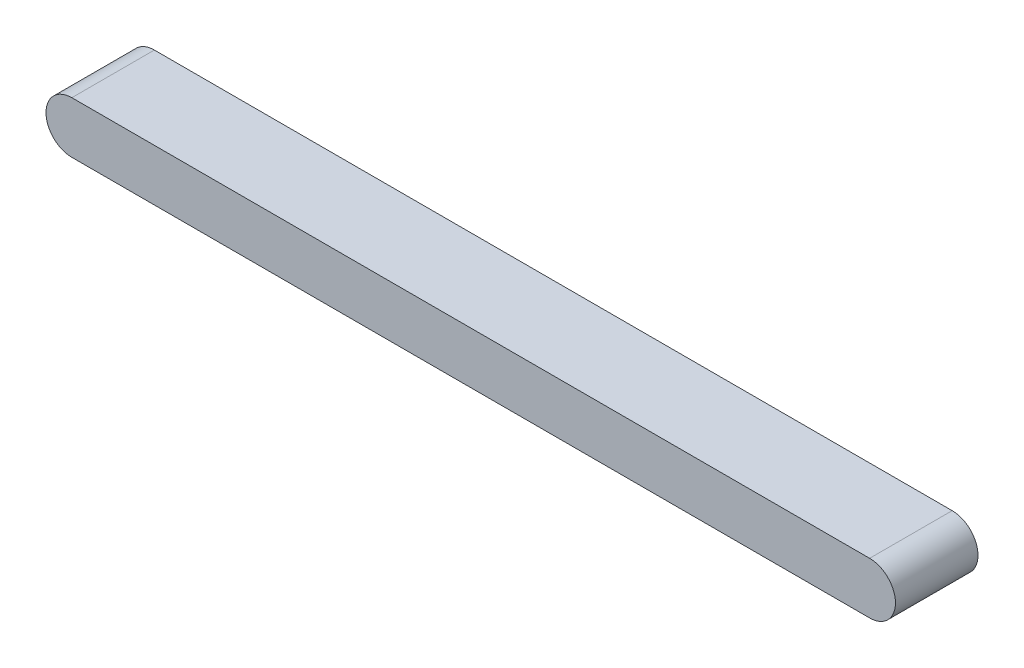
from build123d import *

# Parameters (mm, degrees)
EXTRUDE_1_DEPTH = 7.5


with BuildPart() as part:
    # 草图1 → 凸台-拉伸1 (new, symmetric)
    with BuildSketch(Plane.XY):
        with BuildLine():
            Line((0, 4.695484364), (145, 4.695484364))
            ThreePointArc((145, 4.695484364), (149.695484364, 0), (145, -4.695484364))
            Line((145, -4.695484364), (0, -4.695484364))
            ThreePointArc((0, -4.695484364), (-4.695484364, 0), (0, 4.695484364))
        make_face()
    extrude(amount=EXTRUDE_1_DEPTH, both=True)


solid = part.part
